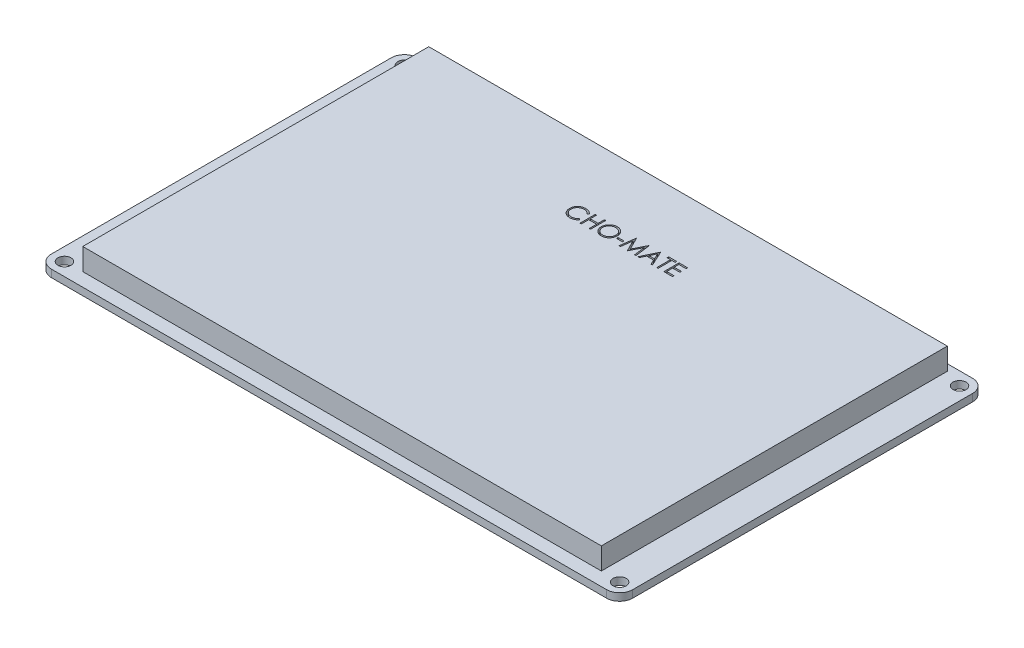
from build123d import *

# Parameters (mm, degrees)
SKETCH1_W           = 133.4
SKETCH1_H           = 84
SKETCH1_R           = 1.5
BOSS_EXTRUDE1_DEPTH = 1.7
SKETCH2_W           = 119
SKETCH2_H           = 79.4
BOSS_EXTRUDE2_DEPTH = 5
SKETCH3_W           = 8.5
SKETCH3_H           = 17.6
BOSS_EXTRUDE3_DEPTH = 7.9
SKETCH4_W           = 1.346153846
SKETCH4_H           = 0.358974359
CUT_EXTRUDE1_DEPTH  = 1
FILLET1_R           = 3


with BuildPart() as part:
    # Sketch1 → Boss-Extrude1 (new body)
    with BuildSketch(Plane(origin=(0, 0, 0), x_dir=(1, 0, 0), z_dir=(0, 1, 0))):
        with Locations((-1270.2, 851.1)):
            Rectangle(SKETCH1_W, SKETCH1_H)
        with Locations(Location((-1333.9, 890.1, 0), (0, 0, 270))):
            Circle(SKETCH1_R, mode=Mode.SUBTRACT)
        with Locations(Location((-1206.5, 890.1, 0), (0, 0, 270))):
            Circle(SKETCH1_R, mode=Mode.SUBTRACT)
        with Locations(Location((-1206.5, 812.1, 0), (0, 0, 270))):
            Circle(SKETCH1_R, mode=Mode.SUBTRACT)
        with Locations(Location((-1333.9, 812.1, 0), (0, 0, 270))):
            Circle(SKETCH1_R, mode=Mode.SUBTRACT)
    extrude(amount=BOSS_EXTRUDE1_DEPTH)

    # Sketch2 → Boss-Extrude2 (add)
    with BuildSketch(Plane(origin=(0, 1.7, 0), x_dir=(1, 0, 0), z_dir=(0, 1, 0))):
        with Locations((-1270.3, 851.9)):
            Rectangle(SKETCH2_W, SKETCH2_H)
    extrude(amount=BOSS_EXTRUDE2_DEPTH)

    # Sketch3 → Boss-Extrude3 (add)
    with BuildSketch(Plane.XZ):
        with Locations((-1332.65, -851.3)):
            Rectangle(SKETCH3_W, SKETCH3_H)
    extrude(amount=BOSS_EXTRUDE3_DEPTH)

    # Sketch4 → Cut-Extrude1 (cut)
    # profile 1 of 8: a face of its own
    with BuildSketch(Plane(origin=(0, 6.7, 0), x_dir=(1, 0, 0), z_dir=(0, 1, 0))):
        with BuildLine():
            Line((-1278.097757363, 876.72635337), (-1278.372597107, 876.516016832))
            add(Edge.make_bspline(
                [(-1278.372597107, 876.516016832), (-1278.392202995, 876.539382801), (-1278.431150442, 876.585799717), (-1278.493809645, 876.650979262), (-1278.559111287, 876.712044523), (-1278.627030409, 876.769286403), (-1278.698789528, 876.820703168), (-1278.772650327, 876.868974271), (-1278.849848372, 876.912242009), (-1278.956600107, 876.964704995), (-1279.096247955, 877.01945115), (-1279.272042794, 877.065354382), (-1279.455553893, 877.094575557), (-1279.580751492, 877.097740399), (-1279.644432043, 877.099350165)],
                knots=[0, 0, 0, 0, 0.757959112, 1.505699292, 2.245454638, 2.979532153, 3.711538275, 4.438200793, 5.171680507, 5.909471876, 7.393775596, 8.890124382, 10.418191784, 12, 12, 12, 12], degree=3))
            add(Edge.make_bspline(
                [(-1279.644432043, 877.099350165), (-1279.679515342, 877.098946202), (-1279.749356335, 877.098142027), (-1279.853004808, 877.087532901), (-1279.954717859, 877.072621691), (-1280.054429326, 877.050496368), (-1280.152012284, 877.022523749), (-1280.248104686, 876.989098335), (-1280.341315286, 876.947743495), (-1280.432933524, 876.902035235), (-1280.520712735, 876.85040779), (-1280.603767783, 876.794094439), (-1280.681795751, 876.733725342), (-1280.754858363, 876.669074236), (-1280.823030311, 876.600432275), (-1280.885817622, 876.527067934), (-1280.943003032, 876.44921576), (-1280.995720057, 876.367902353), (-1281.042932791, 876.283364561), (-1281.08246267, 876.195289491), (-1281.117467792, 876.105185388), (-1281.145167035, 876.012034227), (-1281.167091552, 875.916491461), (-1281.182219215, 875.818300673), (-1281.192707686, 875.717666993), (-1281.193507863, 875.649457681), (-1281.193911209, 875.615075325)],
                knots=[0, 0, 0, 0, 1.054917814, 2.100044995, 3.131103042, 4.146048494, 5.169673617, 6.183595914, 7.203665975, 8.234915748, 9.262203917, 10.264457458, 11.251630812, 12.227803204, 13.197192746, 14.159520551, 15.12972552, 16.100847026, 17.073214652, 18.039054194, 19.002613845, 19.979014051, 20.95965708, 21.949030935, 22.966165397, 24, 24, 24, 24], degree=3))
            add(Edge.make_bspline(
                [(-1281.193911209, 875.615075325), (-1281.19264939, 875.563344005), (-1281.190171976, 875.46177642), (-1281.168123642, 875.31300581), (-1281.134618551, 875.170485136), (-1281.084402974, 875.035105294), (-1281.022483923, 874.905196936), (-1280.944243312, 874.782958082), (-1280.853626774, 874.666541518), (-1280.749352355, 874.55869857), (-1280.634946539, 874.460184845), (-1280.512198627, 874.373434263), (-1280.38141434, 874.301119381), (-1280.244037709, 874.240943434), (-1280.099011595, 874.194686707), (-1279.946596793, 874.162122583), (-1279.787124798, 874.140880403), (-1279.678155398, 874.138846714), (-1279.622697267, 874.137811703)],
                knots=[0, 0, 0, 0, 1.029171465, 2.020641659, 2.987623507, 3.938342917, 4.889210282, 5.84687017, 6.821220943, 7.821438502, 8.827599549, 9.822697543, 10.807740252, 11.797342354, 12.80366471, 13.83203677, 14.896651826, 16, 16, 16, 16], degree=3))
            add(Edge.make_bspline(
                [(-1279.622697267, 874.137811703), (-1279.561594578, 874.139500483), (-1279.441329869, 874.142824406), (-1279.264961843, 874.170983655), (-1279.096126077, 874.216641573), (-1278.934813491, 874.280539495), (-1278.781478845, 874.363604783), (-1278.635882184, 874.46430266), (-1278.497900614, 874.583590993), (-1278.414929331, 874.674674121), (-1278.372597107, 874.721145037)],
                knots=[0, 0, 0, 0, 1.028121516, 2.023589091, 2.998037872, 3.967518031, 4.937445131, 5.927275754, 6.942489185, 8, 8, 8, 8], degree=3))
            Line((-1278.372597107, 874.721145037), (-1278.097757363, 874.512911864))
            add(Edge.make_bspline(
                [(-1278.097757363, 874.512911864), (-1278.119875473, 874.484373412), (-1278.164005748, 874.427433205), (-1278.235463765, 874.347161496), (-1278.310741063, 874.27165746), (-1278.390396773, 874.201529839), (-1278.473514564, 874.135375373), (-1278.561586877, 874.075073542), (-1278.653455909, 874.019782658), (-1278.748810388, 873.969155733), (-1278.847549001, 873.924238486), (-1278.949553436, 873.885784718), (-1279.054384011, 873.852659829), (-1279.16204552, 873.825407892), (-1279.272761277, 873.804136808), (-1279.386131751, 873.789917134), (-1279.502401626, 873.780175219), (-1279.580843047, 873.779287303), (-1279.620593902, 873.778837344)],
                knots=[0, 0, 0, 0, 0.986787822, 1.968848986, 2.935600012, 3.899624008, 4.868462664, 5.837806735, 6.815139263, 7.798259679, 8.787526145, 9.778297419, 10.776456485, 11.791383307, 12.812564526, 13.85620153, 14.913611965, 16, 16, 16, 16], degree=3))
            add(Edge.make_bspline(
                [(-1279.620593902, 873.778837344), (-1279.658237569, 873.779099337), (-1279.732673259, 873.779617395), (-1279.842572011, 873.788009562), (-1279.949561591, 873.799459299), (-1280.053336217, 873.81669943), (-1280.154462192, 873.83704377), (-1280.252022777, 873.864315027), (-1280.346977987, 873.894864193), (-1280.438946328, 873.93076918), (-1280.528006028, 873.971285363), (-1280.613869839, 874.017076922), (-1280.696498271, 874.067758786), (-1280.776703692, 874.122213797), (-1280.853301276, 874.182191099), (-1280.926954801, 874.246857733), (-1280.998077277, 874.315995744), (-1281.042079962, 874.365850597), (-1281.064203677, 874.390916671)],
                knots=[0, 0, 0, 0, 1.114604814, 2.203992996, 3.262667896, 4.300477797, 5.318619304, 6.316056647, 7.298880507, 8.271930387, 9.238335007, 10.195173496, 11.151986948, 12.108099108, 13.064862484, 14.031167946, 15.010108607, 16, 16, 16, 16], degree=3))
            add(Edge.make_bspline(
                [(-1281.064203677, 874.390916671), (-1281.099639321, 874.43445786), (-1281.170082798, 874.521014571), (-1281.260208481, 874.661300552), (-1281.337356036, 874.807768761), (-1281.399731957, 874.96118869), (-1281.44849469, 875.121216077), (-1281.482275885, 875.287931591), (-1281.50422749, 875.461179533), (-1281.506737779, 875.579016322), (-1281.508013774, 875.638913466)],
                knots=[0, 0, 0, 0, 0.994628077, 1.977248131, 2.950237994, 3.925870899, 4.908910175, 5.911660606, 6.938484602, 8, 8, 8, 8], degree=3))
            add(Edge.make_bspline(
                [(-1281.508013774, 875.638913466), (-1281.50645858, 875.70186892), (-1281.503398834, 875.825729844), (-1281.477403038, 876.007503798), (-1281.435584242, 876.181655196), (-1281.376187354, 876.347858941), (-1281.300882002, 876.506989221), (-1281.207855388, 876.657830426), (-1281.098188246, 876.801347226), (-1280.972740678, 876.935361977), (-1280.835173343, 877.05790133), (-1280.687854529, 877.165707533), (-1280.531072582, 877.255425049), (-1280.366554731, 877.330421212), (-1280.193069049, 877.388065675), (-1280.01098568, 877.428418862), (-1279.820646765, 877.453535978), (-1279.690784339, 877.456711186), (-1279.624800633, 877.458324524)],
                knots=[0, 0, 0, 0, 1.032925535, 2.032216505, 3.007276963, 3.968222605, 4.92396291, 5.891752235, 6.871517503, 7.883894988, 8.900124299, 9.891468569, 10.874487609, 11.85992873, 12.854644235, 13.869047385, 14.917252991, 16, 16, 16, 16], degree=3))
            add(Edge.make_bspline(
                [(-1279.624800633, 877.458324524), (-1279.584586161, 877.457842386), (-1279.504985663, 877.456888042), (-1279.387233011, 877.4475819), (-1279.272590684, 877.432068293), (-1279.160979702, 877.410952224), (-1279.051857086, 877.384744902), (-1278.946056845, 877.350604604), (-1278.842958158, 877.311568072), (-1278.74321125, 877.266609606), (-1278.6472947, 877.216142865), (-1278.555238381, 877.160727242), (-1278.467773522, 877.100431436), (-1278.384284674, 877.035768261), (-1278.306168463, 876.965369701), (-1278.231206984, 876.891172105), (-1278.161945906, 876.811038281), (-1278.119192711, 876.754633347), (-1278.097757363, 876.72635337)],
                knots=[0, 0, 0, 0, 1.096760587, 2.17092713, 3.219439832, 4.250915756, 5.268269357, 6.278326846, 7.281116186, 8.274029601, 9.260640565, 10.235837813, 11.203064059, 12.156899882, 13.114053108, 14.069676657, 15.032185724, 16, 16, 16, 16], degree=3))
        make_face()
    # profile 2 of 8: a face of its own
    with BuildSketch(Plane(origin=(0, 6.7, 0), x_dir=(1, 0, 0), z_dir=(0, 1, 0))):
        Polygon((-1277.379808645, 877.368580934), (-1277.065706081, 877.368580934), (-1277.065706081, 875.932683498), (-1275.270834286, 875.932683498), (-1275.270834286, 877.368580934), (-1274.956731722, 877.368580934), (-1274.956731722, 873.868580934), (-1275.270834286, 873.868580934), (-1275.270834286, 875.573709139), (-1277.065706081, 875.573709139), (-1277.065706081, 873.868580934), (-1277.379808645, 873.868580934), align=None)
    # profile 3 of 8: a face of its own
    with BuildSketch(Plane(origin=(0, 6.7, 0), x_dir=(1, 0, 0), z_dir=(0, 1, 0))):
        with BuildLine():
            add(Edge.make_bspline(
                [(-1272.421475312, 877.458324524), (-1272.356667206, 877.456683045), (-1272.229378739, 877.453459044), (-1272.042303841, 877.42877994), (-1271.863708746, 877.38608455), (-1271.692138607, 877.329221568), (-1271.529645631, 877.253367182), (-1271.375006738, 877.161682034), (-1271.228589864, 877.053205575), (-1271.092368483, 876.928776348), (-1270.967711533, 876.793392894), (-1270.857885646, 876.648914984), (-1270.765843353, 876.496216182), (-1270.690257565, 876.335755351), (-1270.630958956, 876.167895383), (-1270.590039912, 875.991741381), (-1270.563901762, 875.808434691), (-1270.560845985, 875.683407826), (-1270.559295825, 875.619983178)],
                knots=[0, 0, 0, 0, 1.065120563, 2.091984664, 3.0946048, 4.079830382, 5.057816894, 6.036188127, 7.030412546, 8.04752943, 9.064399622, 10.05169764, 11.02544977, 11.989514704, 12.962713494, 13.945757189, 14.957906945, 16, 16, 16, 16], degree=3))
            add(Edge.make_bspline(
                [(-1270.559295825, 875.619983178), (-1270.560845757, 875.557025731), (-1270.563900854, 875.432929311), (-1270.590069631, 875.250785867), (-1270.631110631, 875.07569517), (-1270.689706898, 874.907949518), (-1270.764932376, 874.747371954), (-1270.857587547, 874.594385), (-1270.966728758, 874.448938501), (-1271.090935609, 874.312625836), (-1271.226336651, 874.187628366), (-1271.371566918, 874.07870949), (-1271.523360238, 873.984985365), (-1271.683669946, 873.910201691), (-1271.850369983, 873.850429771), (-1272.024952306, 873.809677141), (-1272.20659886, 873.783390098), (-1272.330469864, 873.780371582), (-1272.39343044, 873.778837344)],
                knots=[0, 0, 0, 0, 1.043624062, 2.057103931, 3.04512605, 4.022047818, 4.998200453, 5.980619268, 6.982898556, 8.009068085, 9.034988726, 10.034168286, 11.015286542, 11.987931943, 12.962482838, 13.94673481, 14.956375938, 16, 16, 16, 16], degree=3))
            add(Edge.make_bspline(
                [(-1272.39343044, 873.778837344), (-1272.456854759, 873.780386731), (-1272.581880975, 873.783440985), (-1272.765418011, 873.80962239), (-1272.941695754, 873.850563694), (-1273.110210106, 873.90907313), (-1273.271055035, 873.984690361), (-1273.424545118, 874.07689474), (-1273.570064265, 874.186301881), (-1273.706406012, 874.310468456), (-1273.83115521, 874.445640008), (-1273.939914585, 874.590474263), (-1274.032139699, 874.742129719), (-1274.107503031, 874.901027243), (-1274.167167491, 875.066398686), (-1274.207872309, 875.239347164), (-1274.234208261, 875.418886669), (-1274.237243107, 875.541129568), (-1274.238783004, 875.603156255)],
                knots=[0, 0, 0, 0, 1.053102029, 2.075944431, 3.073151272, 4.055350789, 5.033113405, 6.020478099, 7.024410459, 8.052272461, 9.079885166, 10.07527673, 11.055994387, 12.023226415, 12.992069828, 13.970394897, 14.97016774, 16, 16, 16, 16], degree=3))
            add(Edge.make_bspline(
                [(-1274.238783004, 875.603156255), (-1274.238248369, 875.644788924), (-1274.237185842, 875.727529047), (-1274.22439415, 875.850395647), (-1274.205832449, 875.971286305), (-1274.179230536, 876.089857253), (-1274.144438869, 876.205818238), (-1274.103386842, 876.319969001), (-1274.053246997, 876.431152724), (-1273.996566348, 876.539896116), (-1273.93330454, 876.644504022), (-1273.863428791, 876.743383605), (-1273.789393423, 876.837364602), (-1273.708230029, 876.924011606), (-1273.622613584, 877.005845262), (-1273.531155206, 877.081607979), (-1273.434412961, 877.15198293), (-1273.331970581, 877.215403271), (-1273.226352307, 877.272762406), (-1273.117475529, 877.321984257), (-1273.006818957, 877.364230318), (-1272.893864309, 877.398471144), (-1272.778911537, 877.42550318), (-1272.661709753, 877.443910533), (-1272.542352326, 877.456734851), (-1272.461941007, 877.457792353), (-1272.421475312, 877.458324524)],
                knots=[0, 0, 0, 0, 1.037015668, 2.060948919, 3.074880161, 4.083647147, 5.086022904, 6.090072063, 7.104153813, 8.122640571, 9.144368836, 10.147691507, 11.138137339, 12.123020368, 13.103399296, 14.087645067, 15.080126199, 16.082011238, 17.087798457, 18.072939717, 19.057185487, 20.037253025, 21.01195951, 21.997135196, 22.992090687, 24, 24, 24, 24], degree=3))
        make_face()
        with BuildLine():
            add(Edge.make_bspline(
                [(-1272.406050633, 877.099350165), (-1272.439265266, 877.098945275), (-1272.505376999, 877.098139365), (-1272.603661535, 877.087523649), (-1272.700653469, 877.07239376), (-1272.796372831, 877.05081224), (-1272.890419121, 877.021408187), (-1272.983668962, 876.987567279), (-1273.075272016, 876.946346188), (-1273.164925874, 876.899773484), (-1273.251840949, 876.848224563), (-1273.33385365, 876.791252796), (-1273.411176294, 876.730194242), (-1273.483619561, 876.664906404), (-1273.550970733, 876.595056802), (-1273.614555434, 876.521704366), (-1273.671825016, 876.442752475), (-1273.724310593, 876.360342068), (-1273.771278433, 876.274580487), (-1273.813043788, 876.186370625), (-1273.847207797, 876.094992938), (-1273.875070173, 876.001438781), (-1273.898169984, 875.905856321), (-1273.912803908, 875.807520472), (-1273.923536267, 875.70692536), (-1273.924296113, 875.638943506), (-1273.92468044, 875.604558498)],
                knots=[0, 0, 0, 0, 1.008559885, 2.007477868, 2.99961109, 3.989939068, 4.984837346, 5.991145699, 7.001802488, 8.033829008, 9.059044045, 10.069351652, 11.065060232, 12.050310815, 13.029377138, 14.011219647, 14.996725999, 15.989392538, 16.977580475, 17.965360261, 18.951710183, 19.937753436, 20.929683414, 21.935841486, 22.955955122, 24, 24, 24, 24], degree=3))
            add(Edge.make_bspline(
                [(-1273.92468044, 875.604558498), (-1273.923405578, 875.553996277), (-1273.92089753, 875.454524747), (-1273.89893996, 875.308756603), (-1273.865117986, 875.168668317), (-1273.815260619, 875.035026408), (-1273.752910005, 874.906682125), (-1273.675883114, 874.78477402), (-1273.584624029, 874.669269146), (-1273.480960502, 874.560973877), (-1273.367637796, 874.462128073), (-1273.247305066, 874.375364664), (-1273.121251458, 874.301954414), (-1272.989148256, 874.242149342), (-1272.851700717, 874.194759604), (-1272.708023165, 874.162280973), (-1272.559072706, 874.140905517), (-1272.457542051, 874.138852761), (-1272.406050633, 874.137811703)],
                knots=[0, 0, 0, 0, 1.032063989, 2.030389145, 3.003944642, 3.970395727, 4.937377036, 5.913328081, 6.909231446, 7.93887556, 8.970685674, 9.976071282, 10.964166581, 11.944589148, 12.933237628, 13.927779006, 14.949070134, 16, 16, 16, 16], degree=3))
            add(Edge.make_bspline(
                [(-1272.406050633, 874.137811703), (-1272.371441131, 874.138287208), (-1272.302800095, 874.139230276), (-1272.200704572, 874.148728953), (-1272.10044836, 874.163960822), (-1272.002172081, 874.185891478), (-1271.905987269, 874.213338684), (-1271.811492466, 874.245946412), (-1271.719694176, 874.286627616), (-1271.629434338, 874.331575567), (-1271.543038096, 874.382815725), (-1271.460562564, 874.437853874), (-1271.384086584, 874.498822495), (-1271.311697513, 874.563140308), (-1271.244069824, 874.632104156), (-1271.181660839, 874.705624377), (-1271.124680707, 874.784165035), (-1271.072215061, 874.86645044), (-1271.025411798, 874.952446693), (-1270.984632699, 875.040976371), (-1270.950036583, 875.13182148), (-1270.922108078, 875.225113052), (-1270.900222617, 875.320673901), (-1270.885142697, 875.418631979), (-1270.874594258, 875.518791321), (-1270.873799181, 875.586535177), (-1270.873398389, 875.6206843)],
                knots=[0, 0, 0, 0, 1.047197238, 2.076906641, 3.100256066, 4.114471768, 5.12198147, 6.126382909, 7.136867548, 8.15857795, 9.17633901, 10.174870724, 11.156907918, 12.133735059, 13.104061851, 14.077631395, 15.04955518, 16.038496417, 17.029181396, 18.010275684, 18.986308667, 19.968651475, 20.955262928, 21.950658345, 22.966943676, 24, 24, 24, 24], degree=3))
            add(Edge.make_bspline(
                [(-1270.873398389, 875.6206843), (-1270.873799502, 875.654599804), (-1270.874595183, 875.721877454), (-1270.885137658, 875.821338272), (-1270.900238548, 875.918591484), (-1270.922001256, 876.013255287), (-1270.95005141, 876.105353812), (-1270.984638741, 876.19480056), (-1271.02542404, 876.281928755), (-1271.072232264, 876.366523052), (-1271.124848088, 876.44769779), (-1271.182342331, 876.525300202), (-1271.245707679, 876.597872943), (-1271.313133704, 876.667207638), (-1271.38630459, 876.731825527), (-1271.464888884, 876.791748048), (-1271.547932561, 876.848421322), (-1271.635859797, 876.899546884), (-1271.726603751, 876.946761117), (-1271.819717709, 876.98721212), (-1271.914146808, 877.021584239), (-1272.00965092, 877.050901204), (-1272.107033899, 877.072309234), (-1272.205637728, 877.087537284), (-1272.305325986, 877.09813567), (-1272.372369206, 877.098944049), (-1272.406050633, 877.099350165)],
                knots=[0, 0, 0, 0, 1.02996197, 2.043119294, 3.035359645, 4.018872909, 4.991431989, 5.957985074, 6.929999688, 7.912076566, 8.892894881, 9.867085534, 10.843653904, 11.817741046, 12.803660682, 13.806313499, 14.818574707, 15.856120519, 16.894564902, 17.924820532, 18.937903209, 19.946497019, 20.957711757, 21.963978472, 22.977135795, 24, 24, 24, 24], degree=3))
        make_face(mode=Mode.SUBTRACT)
    # profile 4 of 8: a face of its own
    with BuildSketch(Plane(origin=(0, 6.7, 0), x_dir=(1, 0, 0), z_dir=(0, 1, 0))):
        with Locations((-1269.482372748, 875.214734781)):
            Rectangle(SKETCH4_W, SKETCH4_H)
    # profile 5 of 8: a face of its own
    with BuildSketch(Plane(origin=(0, 6.7, 0), x_dir=(1, 0, 0), z_dir=(0, 1, 0))):
        Polygon((-1268.405449671, 873.868580934), (-1267.943410408, 877.368580934), (-1267.898538613, 877.368580934), (-1266.453526594, 874.496786062), (-1265.012020184, 877.368580934), (-1264.966447267, 877.368580934), (-1264.501603517, 873.868580934), (-1264.817108325, 873.868580934), (-1265.152244543, 876.387010421), (-1266.415666017, 873.868580934), (-1266.486479318, 873.868580934), (-1267.754808645, 876.392619396), (-1268.089243741, 873.868580934), align=None)
    # profile 6 of 8: a face of its own
    with BuildSketch(Plane(origin=(0, 6.7, 0), x_dir=(1, 0, 0), z_dir=(0, 1, 0))):
        Polygon((-1262.347757363, 877.368580934), (-1260.732372748, 873.868580934), (-1261.073819062, 873.868580934), (-1261.591246947, 874.990375806), (-1263.177885568, 874.990375806), (-1263.710037011, 873.868580934), (-1264.052885568, 873.868580934), (-1262.392629158, 877.368580934), align=None)
        Polygon((-1262.37369887, 876.686389428), (-1263.007512972, 875.349350165), (-1261.75671169, 875.349350165), align=None, mode=Mode.SUBTRACT)
    # profile 7 of 8: a face of its own
    with BuildSketch(Plane(origin=(0, 6.7, 0), x_dir=(1, 0, 0), z_dir=(0, 1, 0))):
        Polygon((-1260.508013774, 877.009606575), (-1260.508013774, 877.368580934), (-1258.668270184, 877.368580934), (-1258.668270184, 877.009606575), (-1259.431090697, 877.009606575), (-1259.431090697, 873.868580934), (-1259.745193261, 873.868580934), (-1259.745193261, 877.009606575), align=None)
    # profile 8 of 8: a face of its own
    with BuildSketch(Plane(origin=(0, 6.7, 0), x_dir=(1, 0, 0), z_dir=(0, 1, 0))):
        Polygon((-1258.129808645, 877.368580934), (-1256.155449671, 877.368580934), (-1256.155449671, 877.009606575), (-1257.815706081, 877.009606575), (-1257.815706081, 875.932683498), (-1256.155449671, 875.932683498), (-1256.155449671, 875.573709139), (-1257.815706081, 875.573709139), (-1257.815706081, 874.227555293), (-1256.155449671, 874.227555293), (-1256.155449671, 873.868580934), (-1258.129808645, 873.868580934), align=None)
    extrude(amount=-CUT_EXTRUDE1_DEPTH, mode=Mode.SUBTRACT)

    # Fillet1
    fillet1_edges = [part.edges().sort_by_distance(p)[0] for p in [
        (-1336.9, 0.85, -893.1),
        (-1203.5, 0.85, -893.1),
        (-1203.5, 0.85, -809.1),
        (-1336.9, 0.85, -809.1),
    ]]
    fillet(fillet1_edges, radius=FILLET1_R)


solid = part.part
